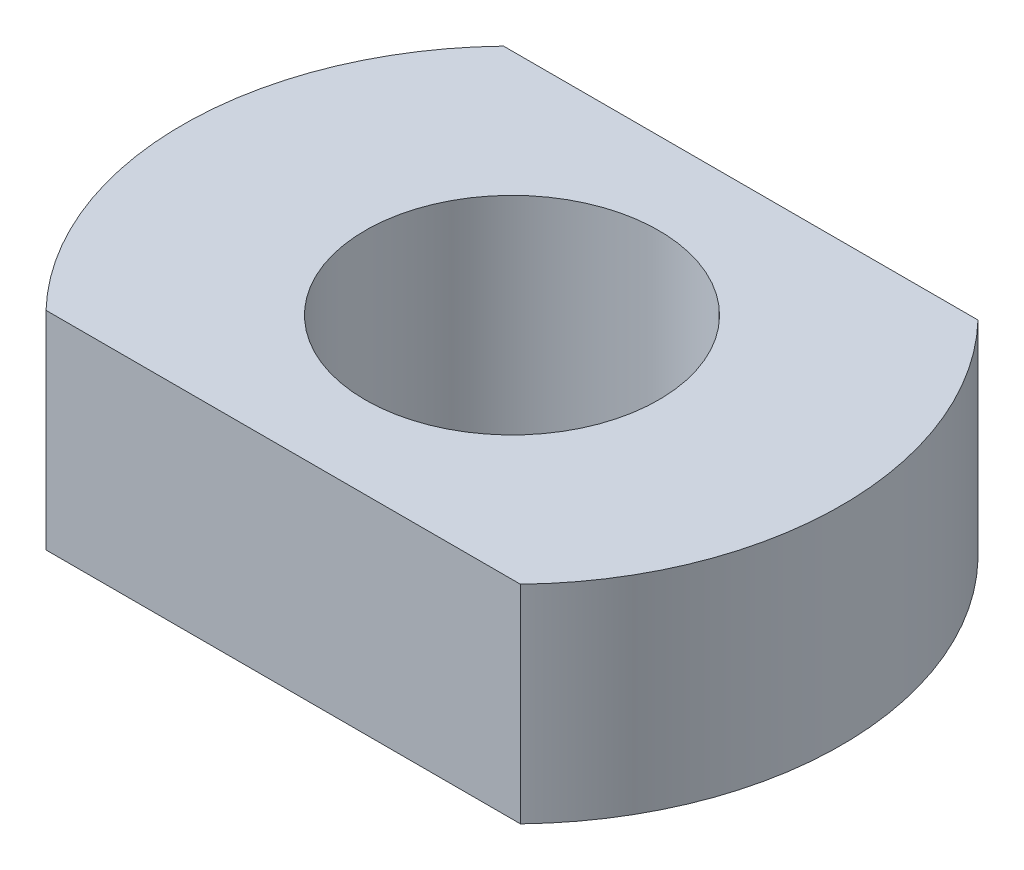
from build123d import *

# Parameters (mm, degrees)
SKETCH1_R           = 4.95
BOSS_EXTRUDE2_DEPTH = 7


with BuildPart() as part:
    # Sketch1 → Boss-Extrude2 (new body)
    with BuildSketch(Plane(origin=(0, 0, 0), x_dir=(1, 0, 0), z_dir=(0, 1, 0))):
        with BuildLine():
            ThreePointArc((-8, 7.716425662), (-11.115, 0), (-8, -7.716425662))
            Line((-8, -7.716425662), (8, -7.716425662))
            ThreePointArc((8, -7.716425662), (11.115, 0), (8, 7.716425662))
            Line((8, 7.716425662), (-8, 7.716425662))
        make_face()
        with Locations(Location((0, 0, 0), (0, 0, 270))):
            Circle(SKETCH1_R, mode=Mode.SUBTRACT)
    extrude(amount=BOSS_EXTRUDE2_DEPTH)


solid = part.part
